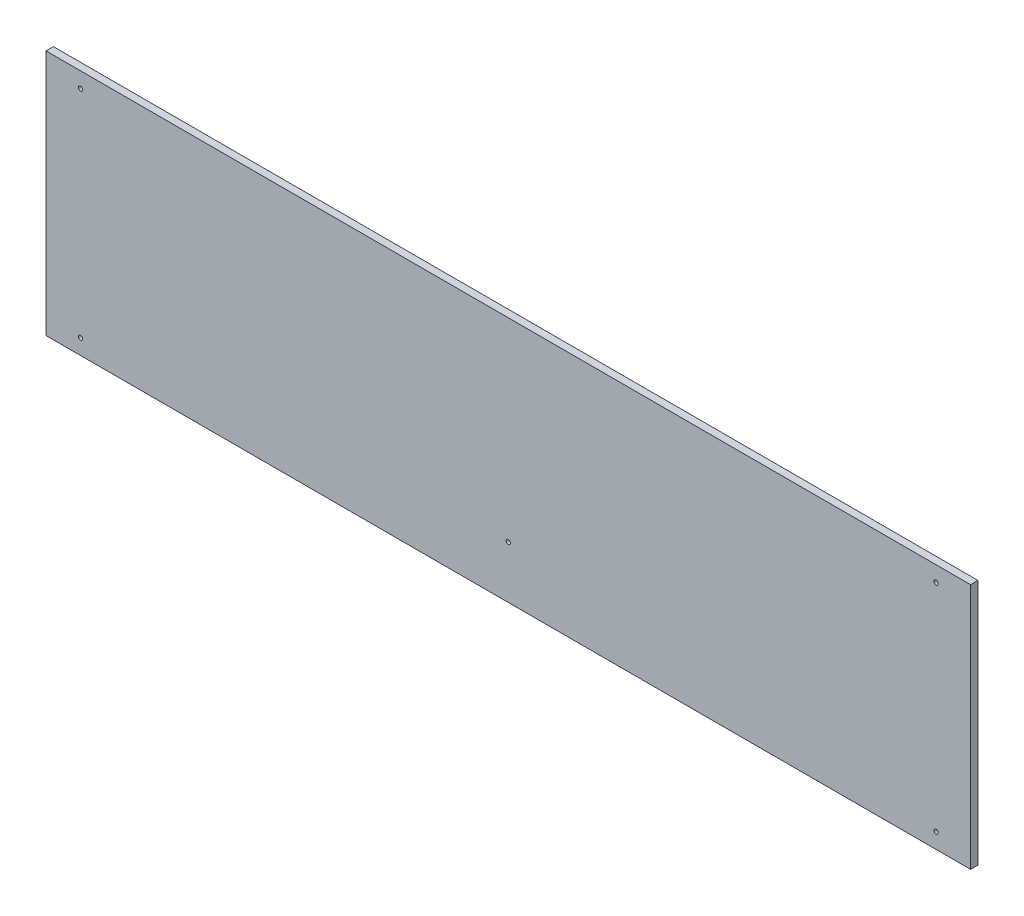
from build123d import *

# Parameters (mm, degrees)
SKETCH1_W                   = 1500
SKETCH1_H                   = 400
RAWMATERIAL_DEPTH           = 12
F_7_0_7_FRAME_MOUNT_HOLES_D = 7


with BuildPart() as part:
    # Sketch1 → RawMaterial (new body)
    with BuildSketch(Plane.XY):
        Rectangle(SKETCH1_W, SKETCH1_H)
    extrude(amount=RAWMATERIAL_DEPTH)

    # Ø7.0 (7) Frame Mount Holes (through all)
    with Locations(Plane(origin=(0, 0, 0), x_dir=(-1, 0, 0), z_dir=(0, 0, -1))):
        with Locations((-694, 175), (-694, -175), (694, -175), (694, 175), (0, -115)):
            Hole(F_7_0_7_FRAME_MOUNT_HOLES_D / 2)


solid = part.part
